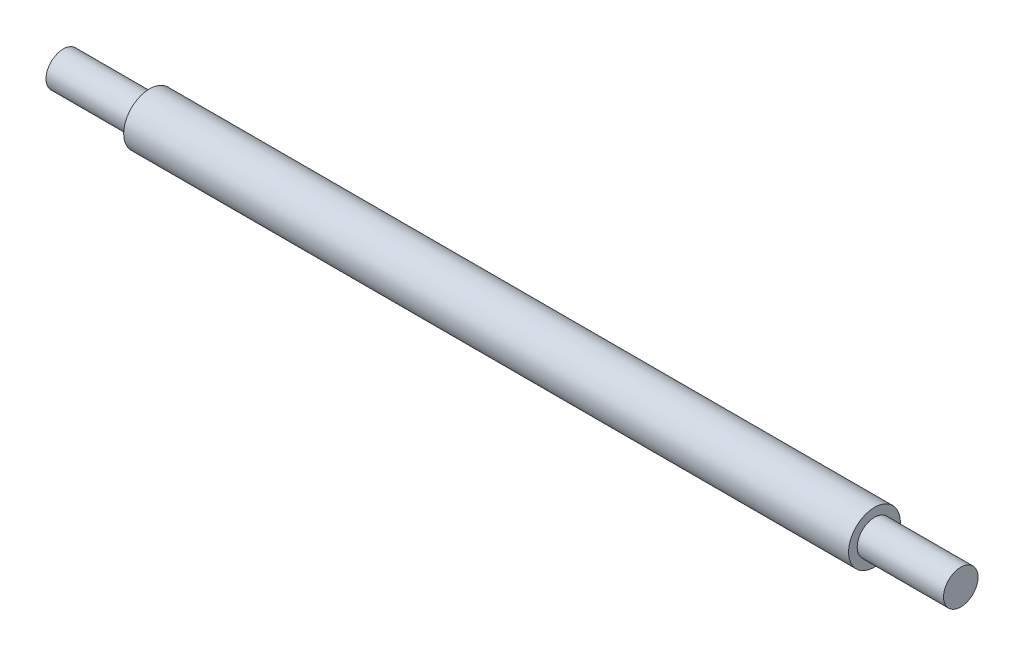
from build123d import *


with BuildPart() as part:
    # Sketch1 → Revolve1 (revolve)
    with BuildSketch(Plane(origin=(0, 0, 0), x_dir=(1, 0, 0), z_dir=(0, 1, 0)), mode=Mode.PRIVATE) as revolve1_sk:
        Polygon((52, 0), (52, 2), (42, 2), (42, 3), (-42, 3), (-42, 2), (-52, 2), (-52, 0), align=None)
    revolve(revolve1_sk.sketch.rotate(Axis((0, 0, 0), (1, 0, 0)), 180), axis=Axis((0, 0, 0), (1, 0, 0)))


solid = part.part
